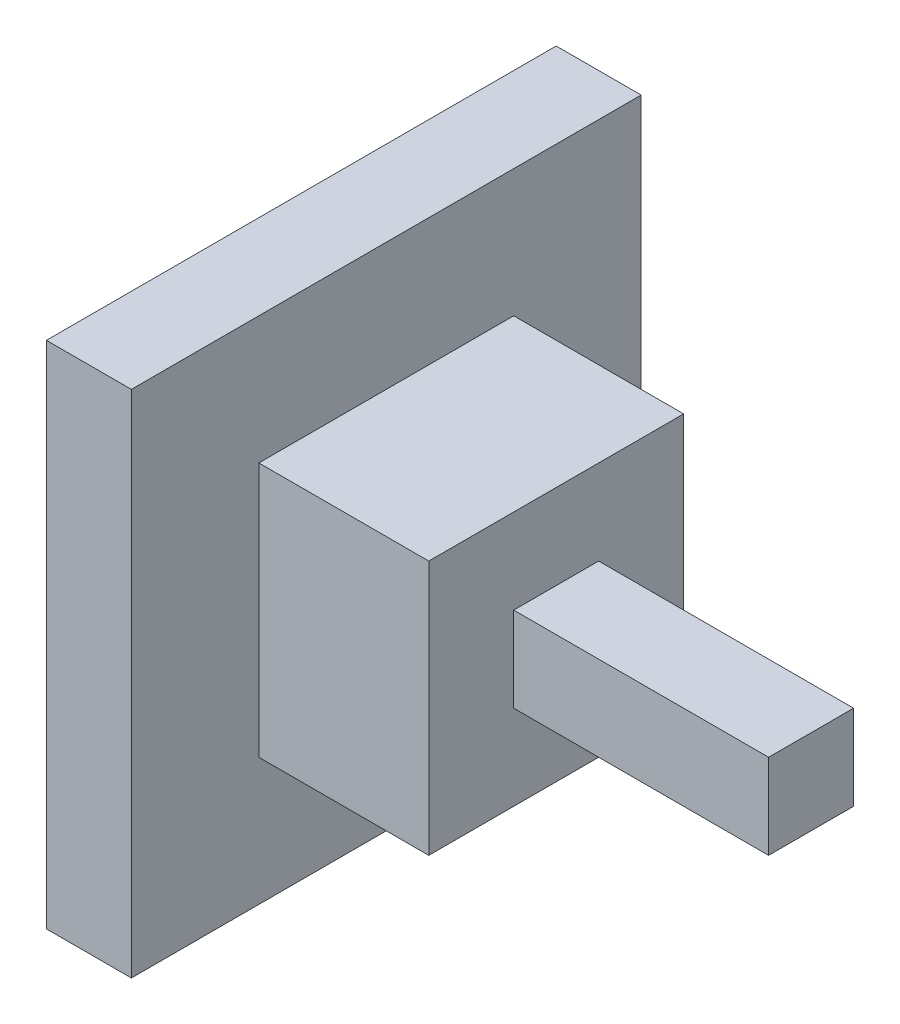
from build123d import *

# Parameters (mm, degrees)
SKETCH1_W           = 25.4
SKETCH1_H           = 25.4
BOSS_EXTRUDE1_DEPTH = 152.4
SKETCH1_3_W         = 76.2
SKETCH1_3_H         = 76.2
SKETCH1_3_W_2       = 25.4
SKETCH1_3_H_2       = 25.4
BOSS_EXTRUDE2_DEPTH = 76.2
SKETCH1_5_W         = 152.4
SKETCH1_5_H         = 152.4
BOSS_EXTRUDE4_DEPTH = 25.4


with BuildPart() as part:
    # Sketch1 → Boss-Extrude1 (new body)
    with BuildSketch(Plane(origin=(0, 0, 0), x_dir=(0, 0, -1), z_dir=(1, 0, 0))):
        Rectangle(SKETCH1_W, SKETCH1_H)
    extrude(amount=BOSS_EXTRUDE1_DEPTH)



with BuildPart() as body_2:
    # Sketch1<3> → Boss-Extrude2 (new body)
    with BuildSketch(Plane(origin=(0, 0, 0), x_dir=(0, 0, -1), z_dir=(1, 0, 0))):
        Rectangle(SKETCH1_3_W, SKETCH1_3_H)
        Rectangle(SKETCH1_3_W_2, SKETCH1_3_H_2, mode=Mode.SUBTRACT)
    extrude(amount=BOSS_EXTRUDE2_DEPTH)


with BuildPart() as part_1:
    add(part.part)

    add(body_2.part)  # Boss-Extrude4 merges body 2
    # Sketch1<5> → Boss-Extrude4 (add)
    with BuildSketch(Plane(origin=(0, 0, 0), x_dir=(0, 0, -1), z_dir=(1, 0, 0))):
        Rectangle(SKETCH1_5_W, SKETCH1_5_H)
    extrude(amount=BOSS_EXTRUDE4_DEPTH)


solid = part_1.part
